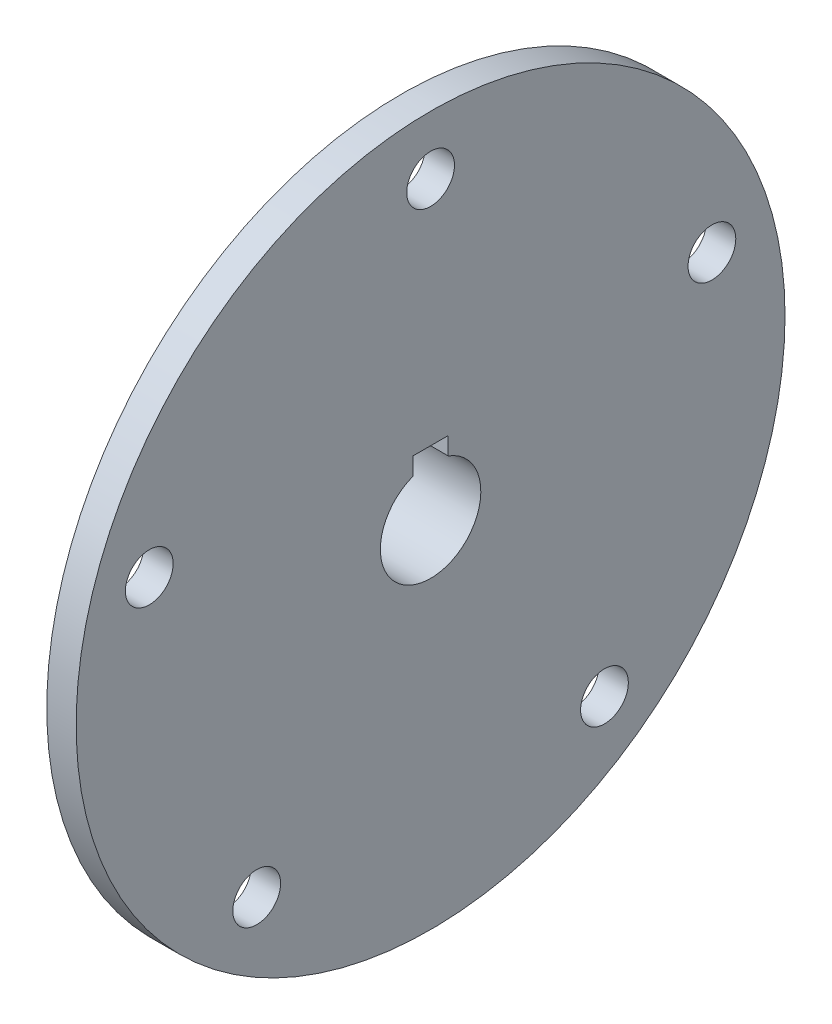
from build123d import *

# Parameters (mm, degrees)
SKETCH1_R                           = 60.325
BOSS_EXTRUDE1_DEPTH                 = 5
SKETCH2_R                           = 4.064
CUT_EXTRUDE1_DEPTH                  = 86.458827806
SKETCH11_R                          = 17.5
BOSS_EXTRUDE3_DEPTH                 = 30
CUT_EXTRUDE5_DEPTH                  = 93.212858377
SKETCH13_R                          = 11
CUT_MOTORSHOULDERRECESS_D22X3_DEPTH = 3


with BuildPart() as part:
    # Sketch1 → Boss-Extrude1 (new body)
    with BuildSketch(Plane(origin=(0, 0, 0), x_dir=(0, 0, -1), z_dir=(1, 0, 0))):
        Circle(SKETCH1_R)
    extrude(amount=-BOSS_EXTRUDE1_DEPTH)

    # Sketch2 → Cut-Extrude1 (cut, through all)
    with BuildSketch(Plane(origin=(0, 0, 0), x_dir=(0, 0, -1), z_dir=(1, 0, 0))):
        with Locations((0, 50.342959834)):
            Circle(SKETCH2_R)
        with Locations((47.879, 15.556830136)):
            Circle(SKETCH2_R)
        with Locations((29.590849347, -40.728310053)):
            Circle(SKETCH2_R)
        with Locations((-29.590849347, -40.728310053)):
            Circle(SKETCH2_R)
        with Locations((-47.879, 15.556830136)):
            Circle(SKETCH2_R)
    extrude(amount=-CUT_EXTRUDE1_DEPTH, mode=Mode.SUBTRACT)

    # Sketch11 → Boss-Extrude3 (add)
    with BuildSketch(Plane.ZY.offset(5)):
        with Locations(Location((0, 0, 0), (0, 0, 180))):
            Circle(SKETCH11_R)
    extrude(amount=BOSS_EXTRUDE3_DEPTH)

    # Sketch12 → Cut-Extrude5 (cut, through all)
    with BuildSketch(Plane.ZY.offset(35)):
        with BuildLine():
            Line((0, 11.006403687), (-3, 11.006403687))
            Line((-3, 11.006403687), (-3, 8.006403687))
            ThreePointArc((-3, 8.006403687), (0, -8.55), (3, 8.006403687))
            Line((3, 8.006403687), (3, 11.006403687))
            Line((3, 11.006403687), (0, 11.006403687))
        make_face()
    extrude(amount=-CUT_EXTRUDE5_DEPTH, mode=Mode.SUBTRACT)

    # Sketch13 → Cut_MotorShoulderRecess_D22x3 (cut)
    with BuildSketch(Plane(origin=(-35, 0, 0), x_dir=(0, 0, -1), z_dir=(1, 0, 0))):
        Circle(SKETCH13_R)
    extrude(amount=CUT_MOTORSHOULDERRECESS_D22X3_DEPTH, mode=Mode.SUBTRACT)


solid = part.part
